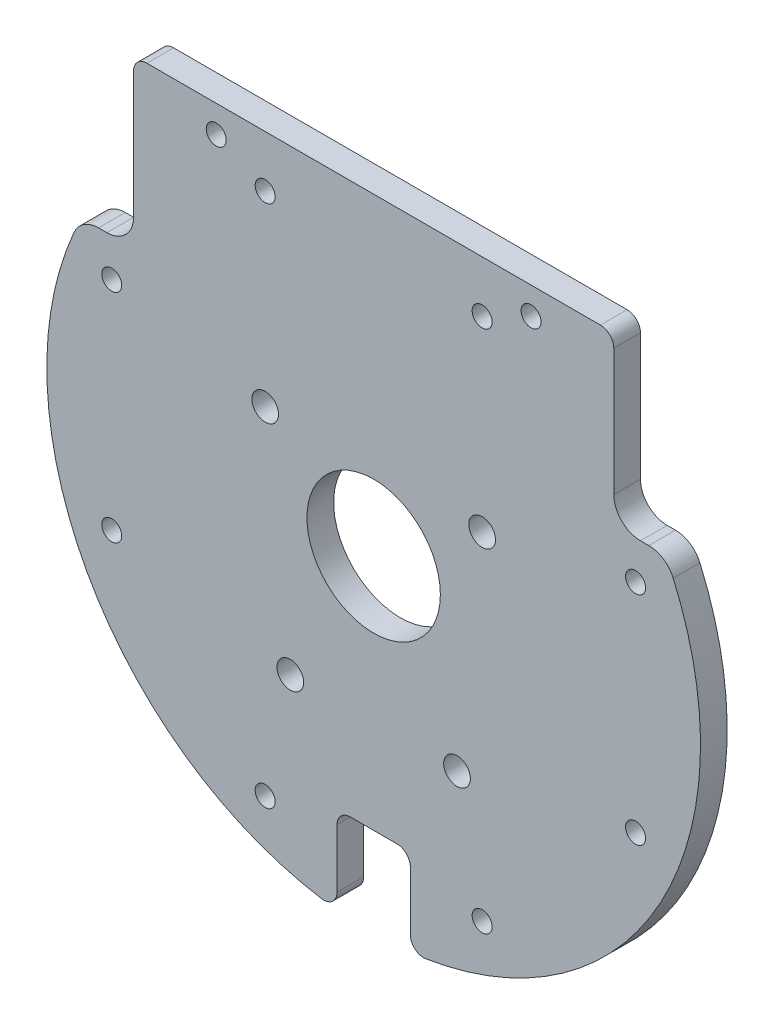
from build123d import *

# Parameters (mm, degrees)
SKETCH_1_R               = 10
SKETCH_1_R_2             = 2
SKETCH_1_R_3             = 1.5
EXTRUDE_1_DEPTH          = 4
CUT_EXTRUDE_1_DEPTH      = 69.987976837
CUT_EXTRUDE_1_DEPTH_BACK = 69.987976837
SKETCH_2_R               = 2
CUT_EXTRUDE_2_DEPTH      = 69.987976837
CUT_EXTRUDE_2_DEPTH_BACK = 69.987976837
SKETCH_3_R               = 1.5
CUT_EXTRUDE_3_DEPTH      = 69.987976837
CUT_EXTRUDE_3_DEPTH_BACK = 69.987976837
SKETCH_4_R               = 1.5


with BuildPart() as part:
    # 草图1 → 凸台-拉伸1 (new body)
    with BuildSketch(Plane.XY):
        with BuildLine():
            Line((-5.5, -46.397737014), (-5.5, -37.610257999))
            ThreePointArc((-5.5, -37.610257999), (-4.914213562, -36.196044437), (-3.5, -35.610257999))
            Line((-3.5, -35.610257999), (3.5, -35.610257999))
            ThreePointArc((3.5, -35.610257999), (4.914213562, -36.196044437), (5.5, -37.610257999))
            Line((5.5, -37.610257999), (5.5, -46.397737014))
            ThreePointArc((5.5, -46.397737014), (6.203523597, -47.920612234), (7.819148936, -48.372108802))
            ThreePointArc((7.819148936, -48.372108802), (43.01305257, -23.470775628), (44.909241811, 19.6))
            ThreePointArc((44.909241811, 19.6), (43.434071485, 21.346640106), (41.243181255, 22))
            Line((41.243181255, 22), (40, 22))
            ThreePointArc((40, 22), (37.171572875, 23.171572875), (36, 26))
            Line((36, 26), (36, 45))
            ThreePointArc((36, 45), (35.414213562, 46.414213562), (34, 47))
            Line((34, 47), (-34, 47))
            ThreePointArc((-34, 47), (-35.414213562, 46.414213562), (-36, 45))
            Line((-36, 45), (-36, 26))
            ThreePointArc((-36, 26), (-37.171572875, 23.171572875), (-40, 22))
            Line((-40, 22), (-41.243181255, 22))
            ThreePointArc((-41.243181255, 22), (-43.434071485, 21.346640106), (-44.909241811, 19.6))
            ThreePointArc((-44.909241811, 19.6), (-43.01305257, -23.470775628), (-7.819148936, -48.372108802))
            ThreePointArc((-7.819148936, -48.372108802), (-6.203523597, -47.920612234), (-5.5, -46.397737014))
        make_face()
        Circle(SKETCH_1_R, mode=Mode.SUBTRACT)
        with Locations((12.5, -21.650635095)):
            Circle(SKETCH_1_R_2, mode=Mode.SUBTRACT)
        with Locations((-12.5, -21.650635095)):
            Circle(SKETCH_1_R_2, mode=Mode.SUBTRACT)
        with Locations((-16.264045876, 39.264880132)):
            Circle(SKETCH_1_R_3, mode=Mode.SUBTRACT)
        with Locations((16.264045876, 39.264880132)):
            Circle(SKETCH_1_R_3, mode=Mode.SUBTRACT)
        with Locations((39.264880132, 16.264045876)):
            Circle(SKETCH_1_R_3, mode=Mode.SUBTRACT)
        with Locations((39.264880132, -16.264045876)):
            Circle(SKETCH_1_R_3, mode=Mode.SUBTRACT)
        with Locations((16.264045876, -39.264880132)):
            Circle(SKETCH_1_R_3, mode=Mode.SUBTRACT)
        with Locations((-16.264045876, -39.264880132)):
            Circle(SKETCH_1_R_3, mode=Mode.SUBTRACT)
        with Locations((-39.264880132, -16.264045876)):
            Circle(SKETCH_1_R_3, mode=Mode.SUBTRACT)
        with Locations((-39.264880132, 16.264045876)):
            Circle(SKETCH_1_R_3, mode=Mode.SUBTRACT)
    extrude(amount=EXTRUDE_1_DEPTH)

    # 草图2 → 切除-拉伸1 (cut, two sides: drawn at the far end of the back side and taken through both)
    with BuildSketch(Plane.XY.offset(4).offset(-CUT_EXTRUDE_1_DEPTH_BACK)):
        with Locations((-16.264045876, 11.264880132)):
            Circle(SKETCH_2_R)
        with Locations((16.264045876, 11.264880132)):
            Circle(SKETCH_2_R)
    extrude(amount=CUT_EXTRUDE_1_DEPTH + CUT_EXTRUDE_1_DEPTH_BACK, mode=Mode.SUBTRACT)

    # 草图3 → 切除-拉伸2 (cut, two sides: drawn at the far end of the back side and taken through both)
    with BuildSketch(Plane(origin=(0, 0, 0), x_dir=(-1, 0, 0), z_dir=(0, 0, -1)).offset(-CUT_EXTRUDE_2_DEPTH_BACK)):
        with Locations((-23.599902633, 42.944396943)):
            Circle(SKETCH_3_R)
    extrude(amount=CUT_EXTRUDE_2_DEPTH + CUT_EXTRUDE_2_DEPTH_BACK, mode=Mode.SUBTRACT)

    # 草图4 → 切除-拉伸3 (cut, two sides: drawn at the far end of the back side and taken through both)
    with BuildSketch(Plane(origin=(0, 0, 0), x_dir=(-1, 0, 0), z_dir=(0, 0, -1)).offset(-CUT_EXTRUDE_3_DEPTH_BACK)):
        with Locations((23.599902633, 42.944396943)):
            Circle(SKETCH_4_R)
    extrude(amount=CUT_EXTRUDE_3_DEPTH + CUT_EXTRUDE_3_DEPTH_BACK, mode=Mode.SUBTRACT)


solid = part.part
